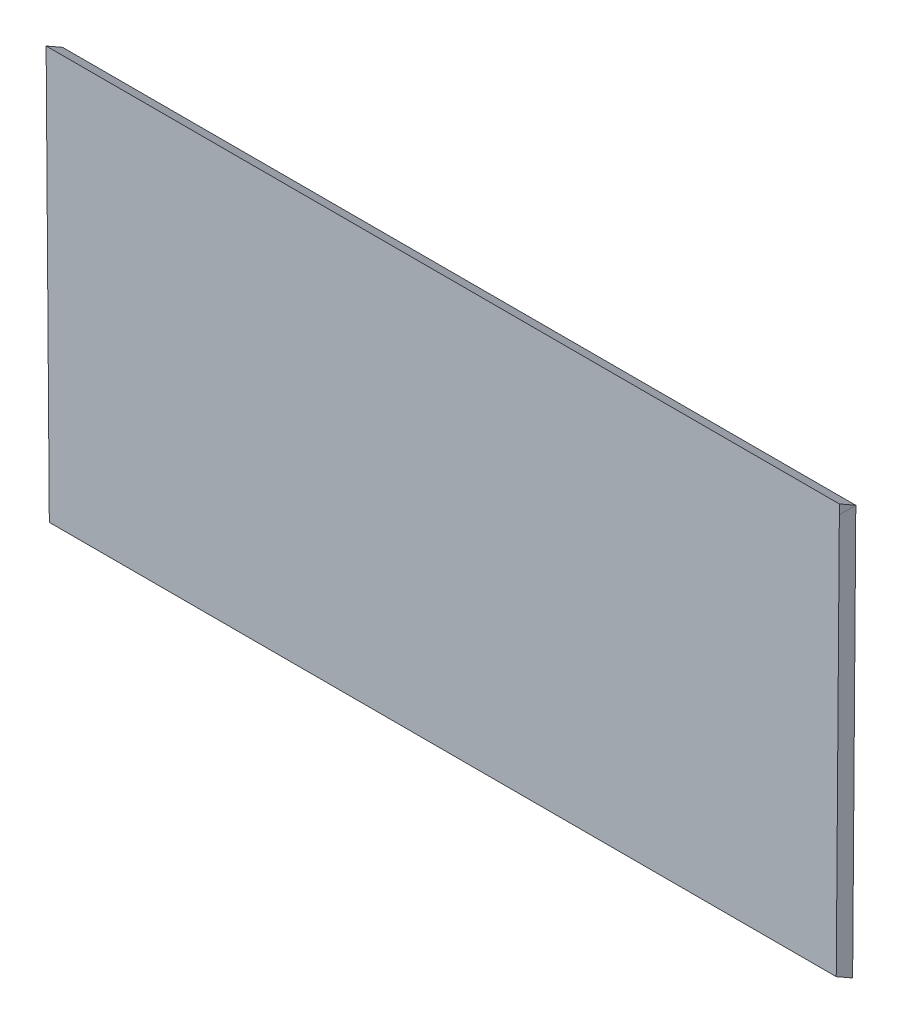
from build123d import *

# Parameters (mm, degrees)
BOSS_EXTRU_1_DEPTH           = 30
BOSS_EXTRU_2_DEPTH           = 817.7
BOSS_EXTRU_2_DEPTH_BACK      = 627.1
ENL_V_MAT_EXTRU_1_DEPTH      = 817.7
ENL_V_MAT_EXTRU_1_DEPTH_BACK = 817.7


with BuildPart() as part:
    # Esquisse1 → Boss.-Extru.1 (new body)
    with BuildSketch(Plane.XY):
        Polygon((-627.102450025, 177.628398295), (-621.287879503, -571.009021535), (811.902120497, -571.009169956), (817.697549975, 177.628398295), align=None)
    extrude(amount=BOSS_EXTRU_1_DEPTH)

    # Esquisse2 → Boss.-Extru.2 (add, two sides: drawn at the far end of the back side and taken through both)
    with BuildSketch(Plane(origin=(0, 0, 0), x_dir=(0, 0, -1), z_dir=(1, 0, 0)).offset(-BOSS_EXTRU_2_DEPTH_BACK)):
        Polygon((0, 177.628398295), (-30, 177.628398295), (-30, 194.767865202), align=None)
    extrude(amount=BOSS_EXTRU_2_DEPTH + BOSS_EXTRU_2_DEPTH_BACK)

    # Esquisse3 → Enlèv. mat.-Extru.1 (cut, two sides: drawn at the far end of the back side and taken through both)
    with BuildSketch(Plane(origin=(0, 0, 0), x_dir=(0, 0, -1), z_dir=(1, 0, 0)).offset(-ENL_V_MAT_EXTRU_1_DEPTH_BACK)):
        Polygon((-30, -571.009169956), (-30, -553.86970305), (0, -571.009169956), align=None)
    extrude(amount=ENL_V_MAT_EXTRU_1_DEPTH + ENL_V_MAT_EXTRU_1_DEPTH_BACK, mode=Mode.SUBTRACT)


solid = part.part
